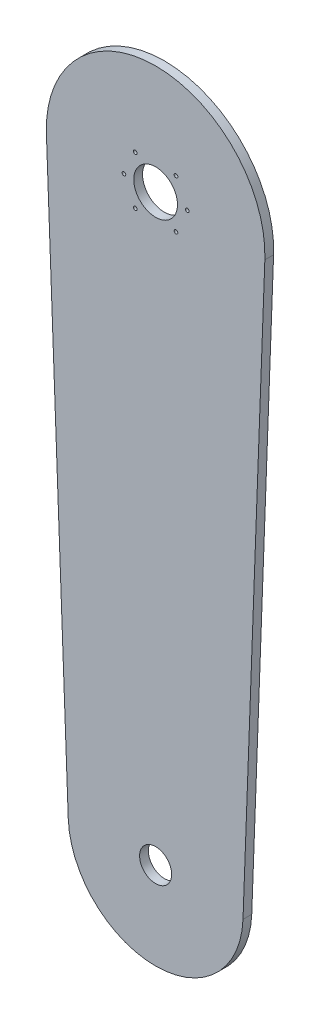
from build123d import *

# Parameters (mm, degrees)
SKETCH_1_R          = 15
SKETCH_1_R_2        = 11
EXTRUDE_1_DEPTH     = 6
SKETCH_2_R          = 1.25
CUT_EXTRUDE_1_DEPTH = 10


with BuildPart() as part:
    # 草图1 → 凸台-拉伸1 (new body)
    with BuildSketch(Plane.XY):
        with BuildLine():
            Line((-74.947247073, -2.8125), (-59.957797658, -402.25))
            ThreePointArc((-59.957797658, -402.25), (0, -460), (59.957797658, -402.25))
            Line((59.957797658, -402.25), (74.947247073, -2.8125))
            ThreePointArc((74.947247073, -2.8125), (0, 75), (-74.947247073, -2.8125))
        make_face()
        Circle(SKETCH_1_R, mode=Mode.SUBTRACT)
        with Locations((0, -400)):
            Circle(SKETCH_1_R_2, mode=Mode.SUBTRACT)
    extrude(amount=EXTRUDE_1_DEPTH)

    # 草图2 → 切除-拉伸1 (cut, symmetric)
    with BuildSketch(Plane.XY.offset(6)):
        with Locations((13.980630511, 16.661466638)):
            Circle(SKETCH_2_R)
        with Locations((21.75, 0)):
            Circle(SKETCH_2_R)
        with Locations((13.980630511, -16.661466638)):
            Circle(SKETCH_2_R)
        with Locations((-13.980630511, 16.661466638)):
            Circle(SKETCH_2_R)
        with Locations((-21.75, 0)):
            Circle(SKETCH_2_R)
        with Locations((-13.980630511, -16.661466638)):
            Circle(SKETCH_2_R)
    extrude(amount=CUT_EXTRUDE_1_DEPTH, both=True, mode=Mode.SUBTRACT)


solid = part.part
